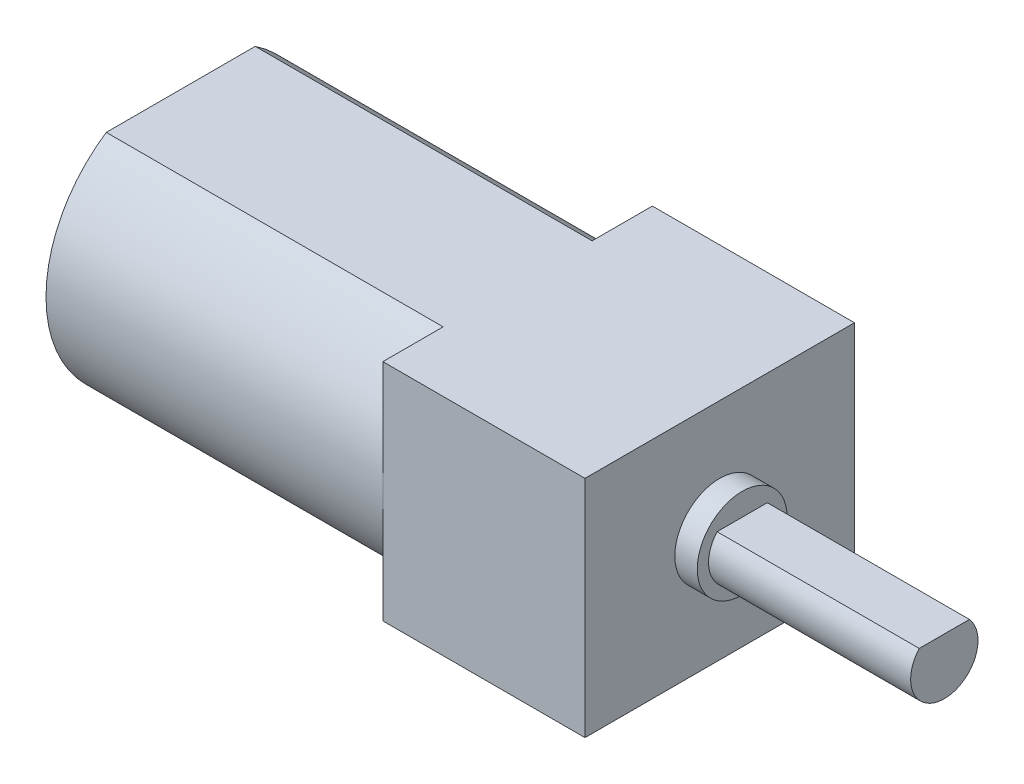
from build123d import *

# Parameters (mm, degrees)
SKETCH_1_W          = 24
SKETCH_1_H          = 12
EXTRUDE_1_DEPTH     = 5
CUT_EXTRUDE_1_DEPTH = 15
SKETCH_2_3_R        = 2.5
EXTRUDE_2_DEPTH     = 1.5
SKETCH_4_R          = 2
EXTRUDE_3_DEPTH     = 1
EXTRUDE_4_DEPTH     = 9


with BuildPart() as part:
    # Эскиз1 → Бобышка-Вытянуть1 (new, symmetric)
    with BuildSketch(Plane(origin=(0, 0, 0), x_dir=(1, 0, 0), z_dir=(0, 1, 0))):
        Rectangle(SKETCH_1_W, SKETCH_1_H)
    extrude(amount=EXTRUDE_1_DEPTH, both=True)

    # Эскиз2 → Вырез-Вытянуть1 (cut)
    with BuildSketch(Plane.ZY.offset(12)):
        with BuildLine():
            Line((6, -5), (6, 0))
            ThreePointArc((6, 0), (5.286764074, -2.837274331), (3.31662479, -5))
            Line((3.31662479, -5), (6, -5))
        make_face()
        with BuildLine():
            ThreePointArc((3.31662479, 5), (5.286764074, 2.837274331), (6, 0))
            Line((6, 0), (6, 5))
            Line((6, 5), (3.31662479, 5))
        make_face()
        with BuildLine():
            ThreePointArc((-6, 0), (-5.286764074, 2.837274331), (-3.31662479, 5))
            Line((-3.31662479, 5), (-6, 5))
            Line((-6, 5), (-6, 0))
        make_face()
        with BuildLine():
            Line((-6, -5), (-3.31662479, -5))
            ThreePointArc((-3.31662479, -5), (-5.286764074, -2.837274331), (-6, 0))
            Line((-6, 0), (-6, -5))
        make_face()
    extrude(amount=-CUT_EXTRUDE_1_DEPTH, mode=Mode.SUBTRACT)

    # Эскиз2<3> → Бобышка-Вытянуть2 (add)
    with BuildSketch(Plane.ZY.offset(12)):
        Circle(SKETCH_2_3_R)
    extrude(amount=EXTRUDE_2_DEPTH)

    # Эскиз4 → Бобышка-Вытянуть3 (add)
    with BuildSketch(Plane(origin=(12, 0, 0), x_dir=(0, 0, -1), z_dir=(1, 0, 0))):
        Circle(SKETCH_4_R)
    extrude(amount=EXTRUDE_3_DEPTH)

    # Эскиз5 → Бобышка-Вытянуть4 (add)
    with BuildSketch(Plane(origin=(13, 0, 0), x_dir=(0, 0, -1), z_dir=(1, 0, 0))):
        with BuildLine():
            Line((1.118033989, 1), (-1.118033989, 1))
            ThreePointArc((-1.118033989, 1), (-0.535233135, -1.401258538), (1.5, 0))
            ThreePointArc((1.5, 0), (1.401258538, 0.535233135), (1.118033989, 1))
        make_face()
    extrude(amount=EXTRUDE_4_DEPTH)


solid = part.part
